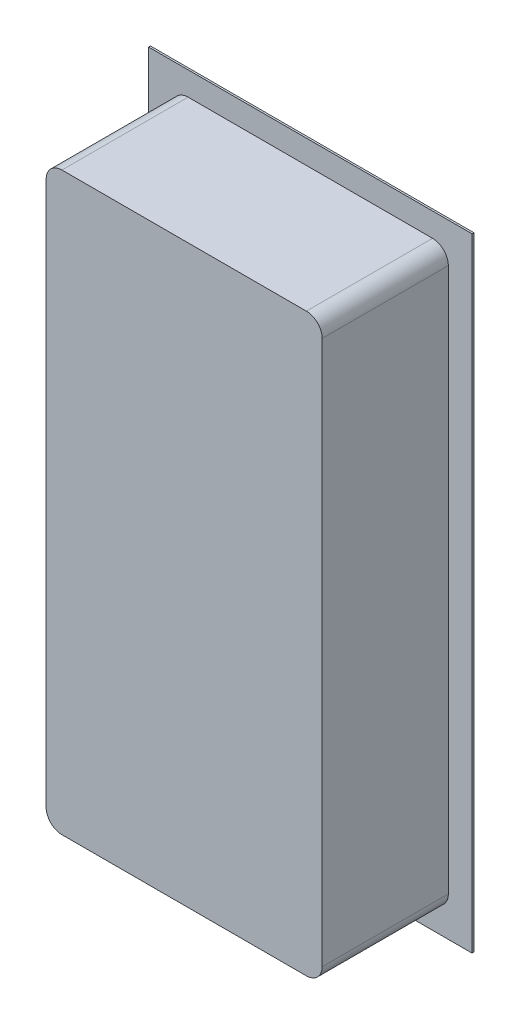
from build123d import *

# Parameters (mm, degrees)
SKETCH1_W           = 222.25
SKETCH1_H           = 463.55
BOSS_EXTRUDE1_DEPTH = 101.6
SKETCH2_W           = 260.35
SKETCH2_H           = 501.65
BOSS_EXTRUDE2_DEPTH = 1.5
FILLET1_R           = 12.7


with BuildPart() as part:
    # Sketch1 → Boss-Extrude1 (new body)
    with BuildSketch(Plane.XY):
        Rectangle(SKETCH1_W, SKETCH1_H)
    extrude(amount=BOSS_EXTRUDE1_DEPTH)

    # Sketch2 → Boss-Extrude2 (add)
    with BuildSketch(Plane(origin=(0, 0, 0), x_dir=(-1, 0, 0), z_dir=(0, 0, -1))):
        Rectangle(SKETCH2_W, SKETCH2_H)
    extrude(amount=BOSS_EXTRUDE2_DEPTH)

    # Fillet1
    fillet1_edges = [part.edges().sort_by_distance(p)[0] for p in [
        (-111.125, 231.775, 50.8),
        (111.125, 231.775, 50.8),
        (111.125, -231.775, 50.8),
        (-111.125, -231.775, 50.8),
    ]]
    fillet(fillet1_edges, radius=FILLET1_R)


solid = part.part
